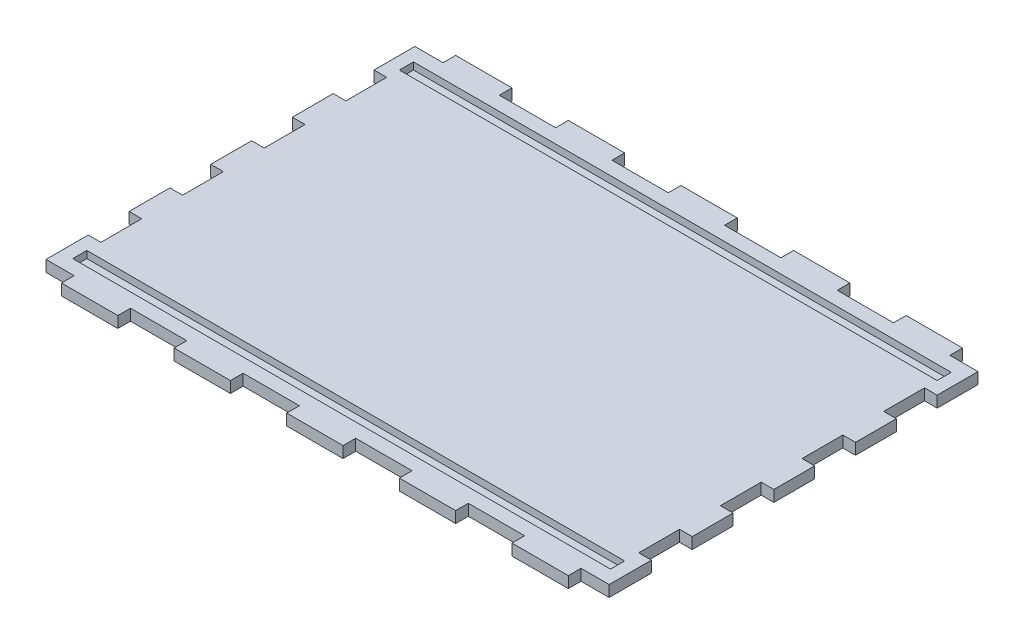
from build123d import *

# Parameters (mm, degrees)
BOSS_EXTRUDE1_DEPTH = 4
SKETCH2_W           = 191
SKETCH2_H           = 5
CUT_EXTRUDE1_DEPTH  = 2.5


with BuildPart() as part:
    # Sketch1 → Boss-Extrude1 (new body)
    with BuildSketch(Plane(origin=(0, 0, 0), x_dir=(1, 0, 0), z_dir=(0, 1, 0))):
        Polygon((-70, 70), (-70, 65.5), (-50, 65.5), (-50, 70), (-30, 70), (-30, 65.5), (-10, 65.5), (-10, 70), (10, 70), (10, 65.5), (30, 65.5), (30, 70), (50, 70), (50, 65.5), (70, 65.5), (70, 70), (90, 70), (90, 65.5), (100, 65.5), (100, 51), (95.5, 51), (95.5, 36.5), (100, 36.5), (100, 22), (95.5, 22), (95.5, 7.5), (100, 7.5), (100, -7), (95.5, -7), (95.5, -21.5), (100, -21.5), (100, -36), (95.5, -36), (95.5, -50.5), (100, -50.5), (100, -65.5), (90, -65.5), (90, -70), (70, -70), (70, -65.5), (50, -65.5), (50, -70), (30, -70), (30, -65.5), (10, -65.5), (10, -70), (-10, -70), (-10, -65.5), (-30, -65.5), (-30, -70), (-50, -70), (-50, -65.5), (-70, -65.5), (-70, -70), (-90, -70), (-90, -65.5), (-100, -65.5), (-100, -50.5), (-95.5, -50.5), (-95.5, -36), (-100, -36), (-100, -21.5), (-95.5, -21.5), (-95.5, -7), (-100, -7), (-100, 7.5), (-95.5, 7.5), (-95.5, 22), (-100, 22), (-100, 36.5), (-95.5, 36.5), (-95.5, 51), (-100, 51), (-100, 65.5), (-90, 65.5), (-90, 70), align=None)
    extrude(amount=BOSS_EXTRUDE1_DEPTH)

    # Sketch2 → Cut-Extrude1 (cut)
    with BuildSketch(Plane(origin=(0, 4, 0), x_dir=(1, 0, 0), z_dir=(0, 1, 0))):
        with Locations((0, 58)):
            Rectangle(SKETCH2_W, SKETCH2_H)
        with Locations((0, -58)):
            Rectangle(SKETCH2_W, SKETCH2_H)
    extrude(amount=-CUT_EXTRUDE1_DEPTH, mode=Mode.SUBTRACT)


solid = part.part
